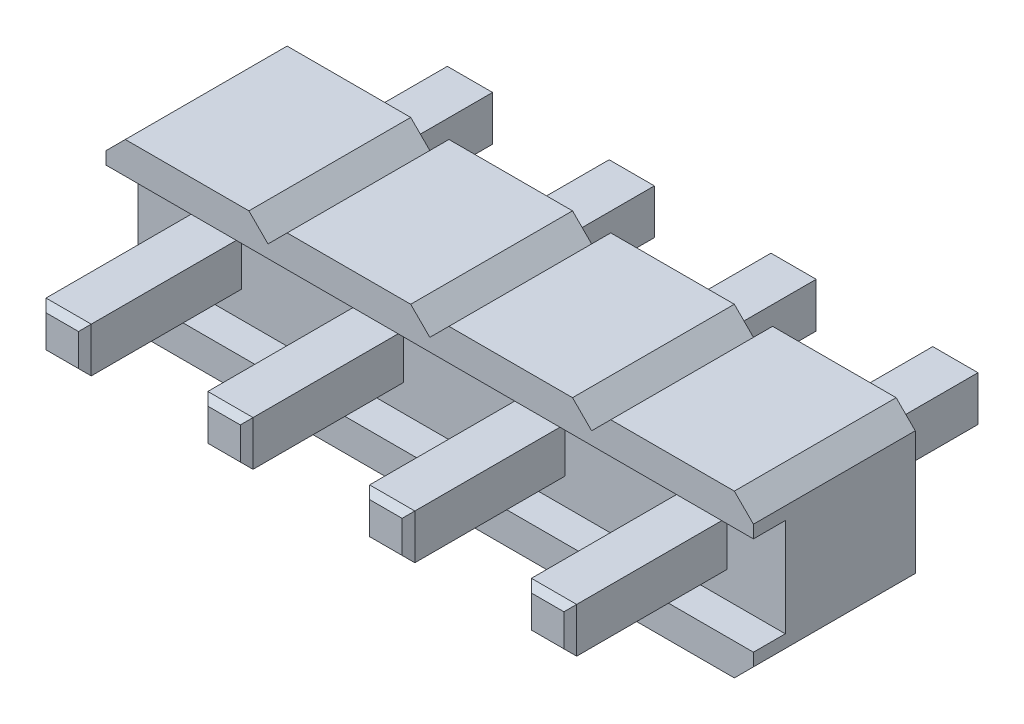
from build123d import *

# Parameters (mm, degrees)
SKETCH_1_W          = 0.709981308
SKETCH_1_H          = 0.70422052
EXTRUDE_1_DEPTH     = 10
EXTRUDE_1_2_DEPTH   = 10
EXTRUDE_1_3_DEPTH   = 10
EXTRUDE_1_4_DEPTH   = 10
EXTRUDE_2_DEPTH     = 2.54
SKETCH_4_W          = 10.16
SKETCH_4_H          = 1.54
CUT_EXTRUDE_2_DEPTH = 0.5
SKETCH_1_2_W        = 0.709981308
SKETCH_1_2_H        = 0.70422052
EXTRUDE_3_DEPTH     = 2
CUT_EXTRUDE_1_DEPTH = 2.54
SKETCH_1_3_W        = 0.709981308
SKETCH_1_3_H        = 0.70422052
EXTRUDE_4_DEPTH     = 4.5
CHAMFER_1_SIZE      = 0.1


with BuildPart() as part:
    # 草图1 → 凸台-拉伸1 (new body)
    with BuildSketch(Plane.XY):
        with Locations((2.54, 0)):
            Rectangle(SKETCH_1_W, SKETCH_1_H)
    extrude(amount=EXTRUDE_1_DEPTH)



with BuildPart() as body_2:
    # 草图1 → Extrude 1 2 (new body)
    with BuildSketch(Plane.XY):
        Rectangle(SKETCH_1_W, SKETCH_1_H)
    extrude(amount=EXTRUDE_1_2_DEPTH)


with BuildPart() as body_3:
    # 草图1 → Extrude 1 3 (new body)
    with BuildSketch(Plane.XY):
        with Locations((5.08, 0)):
            Rectangle(SKETCH_1_W, SKETCH_1_H)
    extrude(amount=EXTRUDE_1_3_DEPTH)


with BuildPart() as body_4:
    # 草图1 → Extrude 1 4 (new body)
    with BuildSketch(Plane.XY):
        with Locations((7.62, 0)):
            Rectangle(SKETCH_1_W, SKETCH_1_H)
    extrude(amount=EXTRUDE_1_4_DEPTH)


with BuildPart() as part_1:
    add(part.part)

    add(body_2.part)  # 凸台-拉伸2 merges body 2

    add(body_3.part)  # 凸台-拉伸2 merges body 3

    add(body_4.part)  # 凸台-拉伸2 merges body 4
    # 草图2 → 凸台-拉伸2 (add)
    with BuildSketch(Plane.XY):
        Polygon((-1.27, 1.27), (1.27, 1.27), (6.35, 1.27), (8.89, 1.27), (8.89, -1.27), (6.35, -1.27), (1.27, -1.27), (-1.27, -1.27), align=None)
    extrude(amount=EXTRUDE_2_DEPTH)

    # 草图4 → 切除-拉伸2 (cut)
    with BuildSketch(Plane.XY.offset(2.54)):
        with Locations((3.81, 0)):
            Rectangle(SKETCH_4_W, SKETCH_4_H)
    extrude(amount=-CUT_EXTRUDE_2_DEPTH, mode=Mode.SUBTRACT)


with BuildPart() as body_2_2:
    # of the pieces the cut leaves, the one that is kept (cut_extrude_2_keep)
    add(part_1.part.solids().sort_by_distance((8.89, 1.27, 0))[0])

    # 草图1<2> → 凸台-拉伸3 (add)
    with BuildSketch(Plane.XY):
        with Locations((2.54, 0)):
            Rectangle(SKETCH_1_2_W, SKETCH_1_2_H)
        Rectangle(SKETCH_1_2_W, SKETCH_1_2_H)
        with Locations((5.08, 0)):
            Rectangle(SKETCH_1_2_W, SKETCH_1_2_H)
        with Locations((7.62, 0)):
            Rectangle(SKETCH_1_2_W, SKETCH_1_2_H)
    extrude(amount=-EXTRUDE_3_DEPTH)

    # 草图3 → 切除-拉伸1 (cut)
    with BuildSketch(Plane(origin=(0, 0, 0), x_dir=(-1, 0, 0), z_dir=(0, 0, -1))):
        Polygon((-8.59, 1.27), (-8.89, 0.97), (-8.89, 1.27), align=None)
        Polygon((-6.05, 1.27), (-6.35, 0.97), (-6.65, 1.27), align=None)
        Polygon((-3.51, 1.27), (-3.81, 0.97), (-4.11, 1.27), align=None)
        Polygon((-0.97, 1.27), (-1.27, 0.97), (-1.57, 1.27), align=None)
        Polygon((1.57, 1.27), (1.27, 0.97), (0.97, 1.27), align=None)
        Polygon((0.97, -1.27), (1.57, -1.27), (1.27, -0.97), align=None)
        Polygon((-1.57, -1.27), (-0.97, -1.27), (-1.27, -0.97), align=None)
        Polygon((-4.11, -1.27), (-3.51, -1.27), (-3.81, -0.97), align=None)
        Polygon((-6.65, -1.27), (-6.05, -1.27), (-6.35, -0.97), align=None)
        Polygon((-8.89, -1.27), (-8.89, -0.97), (-8.59, -1.27), align=None)
    extrude(amount=-CUT_EXTRUDE_1_DEPTH, mode=Mode.SUBTRACT)

    # 草图1<3> → 凸台-拉伸4 (add)
    with BuildSketch(Plane.XY):
        with Locations((2.54, 0)):
            Rectangle(SKETCH_1_3_W, SKETCH_1_3_H)
        Rectangle(SKETCH_1_3_W, SKETCH_1_3_H)
        with Locations((5.08, 0)):
            Rectangle(SKETCH_1_3_W, SKETCH_1_3_H)
        with Locations((7.62, 0)):
            Rectangle(SKETCH_1_3_W, SKETCH_1_3_H)
    extrude(amount=EXTRUDE_4_DEPTH)

    # 倒角1
    chamfer_1_edges = [body_2_2.edges().sort_by_distance(p)[0] for p in [
        (7.62, -0.35211026, 4.5),
        (7.265009346, 0, 4.5),
        (7.62, 0.35211026, 4.5),
        (7.974990654, 0, 4.5),
        (5.08, -0.35211026, 4.5),
        (4.725009346, 0, 4.5),
        (5.08, 0.35211026, 4.5),
        (5.434990654, 0, 4.5),
        (2.54, -0.35211026, 4.5),
        (2.185009346, 0, 4.5),
        (2.54, 0.35211026, 4.5),
        (2.894990654, 0, 4.5),
        (0, -0.35211026, 4.5),
        (-0.354990654, 0, 4.5),
        (0, 0.35211026, 4.5),
        (0.354990654, 0, 4.5),
        (7.62, 0.35211026, -2),
        (7.265009346, 0, -2),
        (7.62, -0.35211026, -2),
        (7.974990654, 0, -2),
        (5.08, 0.35211026, -2),
        (4.725009346, 0, -2),
        (5.08, -0.35211026, -2),
        (5.434990654, 0, -2),
        (2.54, 0.35211026, -2),
        (2.185009346, 0, -2),
        (2.54, -0.35211026, -2),
        (2.894990654, 0, -2),
        (0, 0.35211026, -2),
        (-0.354990654, 0, -2),
        (0, -0.35211026, -2),
        (0.354990654, 0, -2),
    ]]
    chamfer(chamfer_1_edges, length=CHAMFER_1_SIZE)


solid = body_2_2.part
